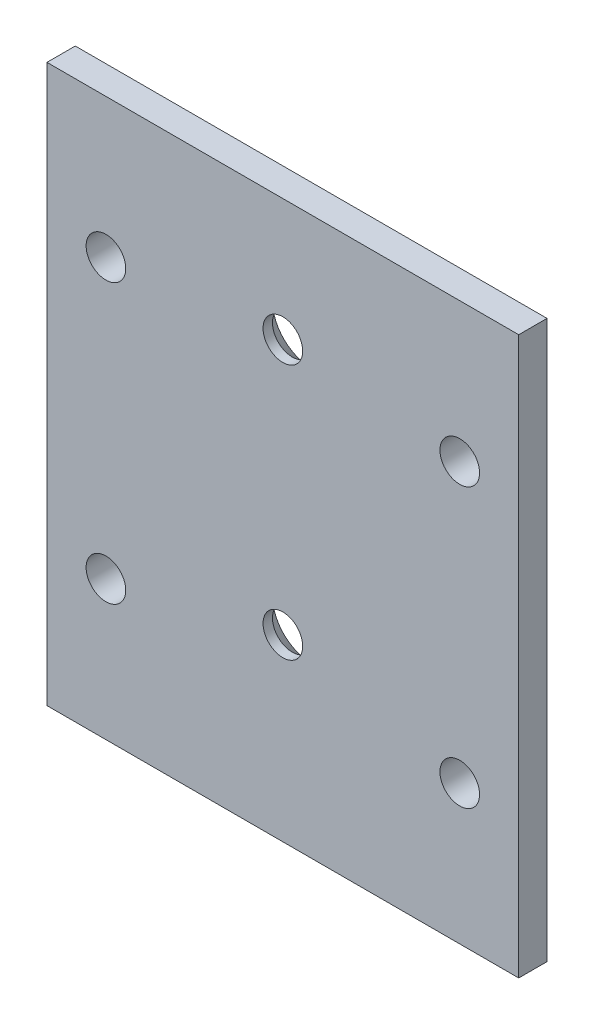
from build123d import *

# Parameters (mm, degrees)
SCHIZZO1_R                   = 2.1
ESTRUSIONE_ESTRUSIONE1_DEPTH = 3
SMUSSO1_SIZE                 = 2


with BuildPart() as part:
    # Schizzo1 → Estrusione-Estrusione1 (new body)
    with BuildSketch(Plane.XY):
        Polygon((0, 71.847389048), (25, 71.847389048), (25, 12.801854913), (0, 12.801854913), (-25, 12.801854913), (-25, 71.847389048), align=None)
        with Locations((18.75, 57.086005514)):
            Circle(SCHIZZO1_R, mode=Mode.SUBTRACT)
        with Locations((18.75, 27.563238447)):
            Circle(SCHIZZO1_R, mode=Mode.SUBTRACT)
        with Locations(Location((-18.75, 27.563238447, 0), (0, 0, 180))):
            Circle(SCHIZZO1_R, mode=Mode.SUBTRACT)
        with Locations(Location((-18.75, 57.086005514, 0), (0, 0, 180))):
            Circle(SCHIZZO1_R, mode=Mode.SUBTRACT)
        with Locations((0, 58.89473309)):
            Circle(SCHIZZO1_R, mode=Mode.SUBTRACT)
        with Locations((0, 31.80362551)):
            Circle(SCHIZZO1_R, mode=Mode.SUBTRACT)
    extrude(amount=ESTRUSIONE_ESTRUSIONE1_DEPTH)

    # Smusso1
    smusso1_edges = [part.edges().sort_by_distance(p)[0] for p in [
        (-2.1, 58.89473309, 0),
        (-2.1, 31.80362551, 0),
    ]]
    chamfer(smusso1_edges, length=SMUSSO1_SIZE)


solid = part.part
